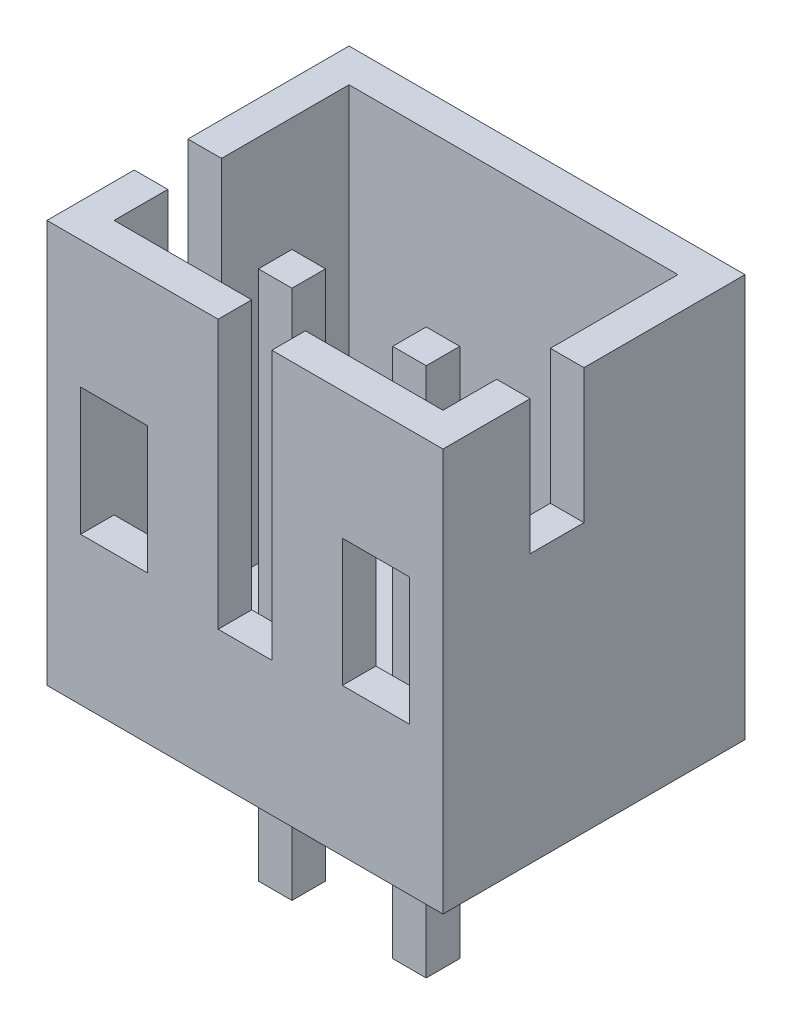
from build123d import *

# Parameters (mm, degrees)
SKETCH1_W           = 5.9
SKETCH1_H           = 4.5
BOSS_EXTRUDE1_DEPTH = 6
SKETCH2_W           = 4.9
SKETCH2_H           = 3.5
CUT_EXTRUDE1_DEPTH  = 5.5
SKETCH3_W           = 1
SKETCH3_H           = 1.9
CUT_EXTRUDE2_DEPTH  = 0.5
BOSS_EXTRUDE2_START = -2.9
SKETCH4_W           = 0.5
SKETCH4_H           = 0.5
BOSS_EXTRUDE2_DEPTH = 7.9
SKETCH5_W           = 0.8
SKETCH5_H           = 2
CUT_EXTRUDE3_DEPTH  = 0.5
SKETCH6_W           = 0.8
SKETCH6_H           = 4
CUT_EXTRUDE4_DEPTH  = 0.5


with BuildPart() as part:
    # Sketch1 → Boss-Extrude1 (new body)
    with BuildSketch(Plane(origin=(0, 0, 0), x_dir=(1, 0, 0), z_dir=(0, 1, 0))):
        Rectangle(SKETCH1_W, SKETCH1_H)
    extrude(amount=BOSS_EXTRUDE1_DEPTH)

    # Sketch2 → Cut-Extrude1 (cut)
    with BuildSketch(Plane(origin=(0, 6, 0), x_dir=(1, 0, 0), z_dir=(0, 1, 0))):
        Rectangle(SKETCH2_W, SKETCH2_H)
    extrude(amount=-CUT_EXTRUDE1_DEPTH, mode=Mode.SUBTRACT)

    # Sketch3 → Cut-Extrude2 (cut)
    with BuildSketch(Plane.XY.offset(2.25)):
        with Locations((-1.95, 3.15)):
            Rectangle(SKETCH3_W, SKETCH3_H)
    cut_extrude2 = extrude(amount=-CUT_EXTRUDE2_DEPTH, mode=Mode.SUBTRACT)

    # Sketch4 → Boss-Extrude2 (add)
    with BuildSketch(Plane(origin=(0, 0.5, 0), x_dir=(1, 0, 0), z_dir=(0, 1, 0)).offset(BOSS_EXTRUDE2_START)):
        with Locations((-1, -0.55)):
            Rectangle(SKETCH4_W, SKETCH4_H)
    boss_extrude2 = extrude(amount=BOSS_EXTRUDE2_DEPTH)

    # Sketch5 → Cut-Extrude3 (cut)
    with BuildSketch(Plane.ZY.offset(2.95)):
        with Locations((0.55, 5)):
            Rectangle(SKETCH5_W, SKETCH5_H)
    cut_extrude3 = extrude(amount=-CUT_EXTRUDE3_DEPTH, mode=Mode.SUBTRACT)

    # Mirror1: Cut-Extrude2, Cut-Extrude3 across plane
    add(cut_extrude2.mirror(Plane(origin=(0, 0, 0), x_dir=(0, 0, 1), z_dir=(1, 0, 0))), mode=Mode.SUBTRACT)
    add(cut_extrude3.mirror(Plane(origin=(0, 0, 0), x_dir=(0, 0, 1), z_dir=(1, 0, 0))), mode=Mode.SUBTRACT)

    # Sketch6 → Cut-Extrude4 (cut)
    with BuildSketch(Plane.XY.offset(2.25)):
        with Locations((0, 4)):
            Rectangle(SKETCH6_W, SKETCH6_H)
    extrude(amount=-CUT_EXTRUDE4_DEPTH, mode=Mode.SUBTRACT)

    # Mirror2: Boss-Extrude2 across plane
    add(boss_extrude2.mirror(Plane(origin=(0, 0, 0), x_dir=(0, 0, 1), z_dir=(1, 0, 0))))


solid = part.part
